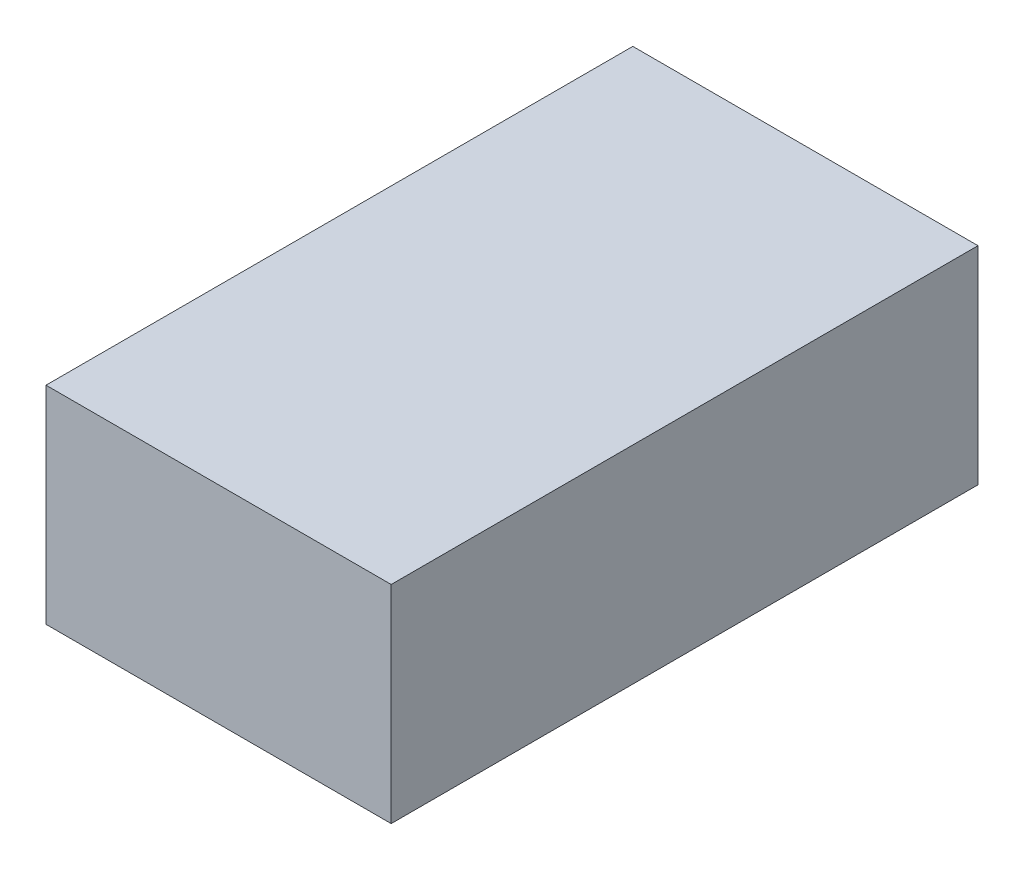
from build123d import *

# Parameters (mm, degrees)
ESQUISSE1_W        = 50
ESQUISSE1_H        = 85
BOSS_EXTRU_1_DEPTH = 30


with BuildPart() as part:
    # Esquisse1 → Boss.-Extru.1 (new body)
    with BuildSketch(Plane(origin=(0, 0, 0), x_dir=(1, 0, 0), z_dir=(0, 1, 0))):
        with Locations((25, 0)):
            Rectangle(ESQUISSE1_W, ESQUISSE1_H)
    extrude(amount=BOSS_EXTRU_1_DEPTH)


solid = part.part
